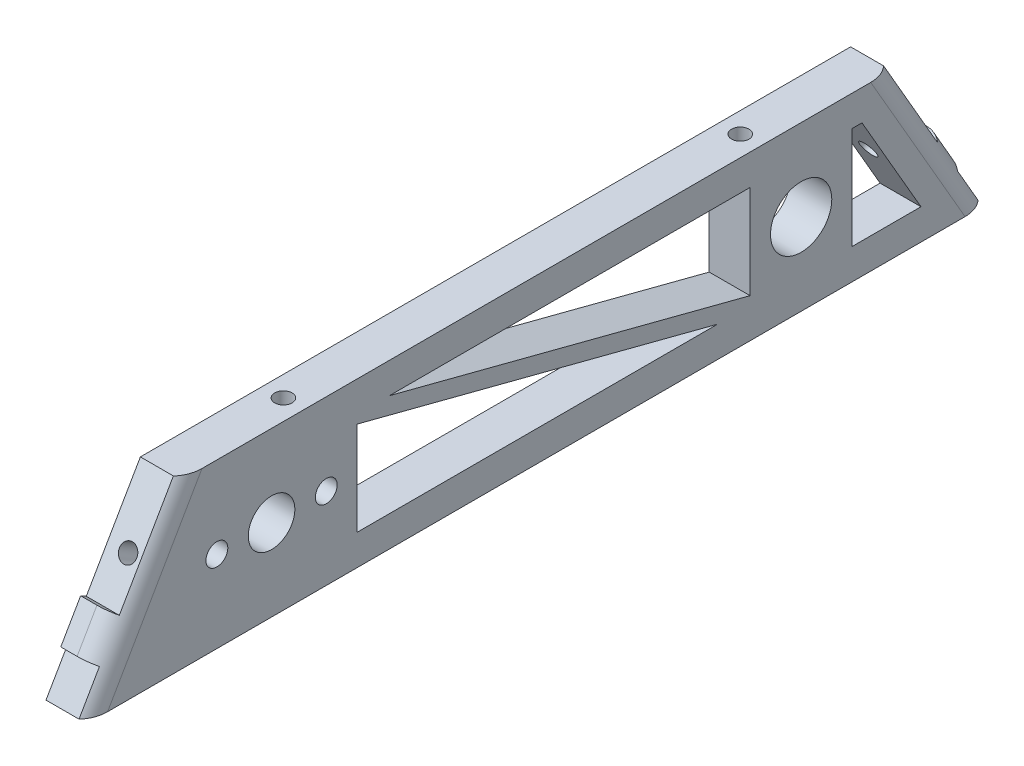
from build123d import *

# Parameters (mm, degrees)
SKETCH1_R                     = 3.6195
SKETCH1_R_2                   = 4.7625
SKETCH1_R_3                   = 1.6999966
BOSS_EXTRUDE1_DEPTH           = 6.35
TAP_DRILL_FOR_6_32_TAP4_D     = 2.7051
TAP_DRILL_FOR_6_32_TAP4_DEPTH = 10.16
TAP_DRILL_FOR_6_32_TAP4_TIP   = 0.81269403
TAP_DRILL_FOR_6_32_TAP3_D     = 2.7051
TAP_DRILL_FOR_6_32_TAP3_DEPTH = 10.16
TAP_DRILL_FOR_6_32_TAP3_TIP   = 0.81269403
SKETCH11_W                    = 6.35
SKETCH11_H                    = 6.1722
BOSS_EXTRUDE2_DEPTH           = 1.016
SKETCH12_W                    = 6.35
SKETCH12_H                    = 6.1722
BOSS_EXTRUDE3_DEPTH           = 1.016
TAP_DRILL_FOR_6_32_TAP1_D     = 2.7051
TAP_DRILL_FOR_6_32_TAP1_DEPTH = 7.62
TAP_DRILL_FOR_6_32_TAP1_TIP   = 0.81269403
TAP_DRILL_FOR_6_32_TAP2_D     = 2.7051
TAP_DRILL_FOR_6_32_TAP2_DEPTH = 7.62
TAP_DRILL_FOR_6_32_TAP2_TIP   = 0.81269403
CUT_EXTRUDE1_DEPTH            = 143.132235964
FILLET1_R                     = 3.81
FILLET2_R                     = 3.81


with BuildPart() as part:
    # Sketch1 → Boss-Extrude1 (new body)
    with BuildSketch(Plane(origin=(0, 0, 0), x_dir=(0, 0, -1), z_dir=(1, 0, 0))):
        Polygon((0, 0), (-14.664696837, 25.4), (-125.035303163, 25.4), (-139.7, 0), align=None)
        with Locations((-110.998, 12.7)):
            Circle(SKETCH1_R, mode=Mode.SUBTRACT)
        with Locations((-28.702, 12.7)):
            Circle(SKETCH1_R_2, mode=Mode.SUBTRACT)
        with Locations((-102.4979916, 12.7)):
            Circle(SKETCH1_R_3, mode=Mode.SUBTRACT)
        with Locations((-119.4980084, 12.7)):
            Circle(SKETCH1_R_3, mode=Mode.SUBTRACT)
    extrude(amount=BOSS_EXTRUDE1_DEPTH)

    # Tap Drill for #6-32 Tap4
    with Locations(Plane(origin=(0, 25.4, 0), x_dir=(1, 0, 0), z_dir=(0, 1, 0))):
        with Locations((3.175, -105.985303163), (3.175, -34.984696837)):
            Hole(TAP_DRILL_FOR_6_32_TAP4_D / 2, depth=TAP_DRILL_FOR_6_32_TAP4_DEPTH)
            with Locations((0, 0, -(TAP_DRILL_FOR_6_32_TAP4_DEPTH + TAP_DRILL_FOR_6_32_TAP4_TIP / 2))):  # 118° drill point
                Cone(0, TAP_DRILL_FOR_6_32_TAP4_D / 2, TAP_DRILL_FOR_6_32_TAP4_TIP, mode=Mode.SUBTRACT)

    # Tap Drill for #6-32 Tap3
    with Locations(Plane(origin=(0, 0, 0), x_dir=(-1, 0, 0), z_dir=(0, -1, 0))):
        with Locations((-3.175, -105.41), (-3.175, -22.86)):
            Hole(TAP_DRILL_FOR_6_32_TAP3_D / 2, depth=TAP_DRILL_FOR_6_32_TAP3_DEPTH)
            with Locations((0, 0, -(TAP_DRILL_FOR_6_32_TAP3_DEPTH + TAP_DRILL_FOR_6_32_TAP3_TIP / 2))):  # 118° drill point
                Cone(0, TAP_DRILL_FOR_6_32_TAP3_D / 2, TAP_DRILL_FOR_6_32_TAP3_TIP, mode=Mode.SUBTRACT)

    # Sketch11 → Boss-Extrude2 (add)
    with BuildSketch(Plane(origin=(0, 60.491874454, 104.775), x_dir=(1, 0, 0), z_dir=(0, 0.5000000000000037, 0.8660254037844365))):
        with Locations((3.175, -60.4139)):
            Rectangle(SKETCH11_W, SKETCH11_H)
    extrude(amount=BOSS_EXTRUDE2_DEPTH)

    # Sketch12 → Boss-Extrude3 (add)
    with BuildSketch(Plane(origin=(0, 0, 0), x_dir=(-1, 0, 0), z_dir=(0, 0.49999999999999806, -0.8660254037844398))):
        with Locations((-3.175, 9.4361)):
            Rectangle(SKETCH12_W, SKETCH12_H)
    extrude(amount=BOSS_EXTRUDE3_DEPTH)

    # Tap Drill for #6-32 Tap1
    with Locations(Plane(origin=(0, 60.491874454, 104.775), x_dir=(1, 0, 0), z_dir=(0, 0.5000000000000037, 0.8660254037844365))):
        with Locations((3.175, -50.680606325)):
            Hole(TAP_DRILL_FOR_6_32_TAP1_D / 2, depth=TAP_DRILL_FOR_6_32_TAP1_DEPTH)
            with Locations((0, 0, -(TAP_DRILL_FOR_6_32_TAP1_DEPTH + TAP_DRILL_FOR_6_32_TAP1_TIP / 2))):  # 118° drill point
                Cone(0, TAP_DRILL_FOR_6_32_TAP1_D / 2, TAP_DRILL_FOR_6_32_TAP1_TIP, mode=Mode.SUBTRACT)

    # Tap Drill for #6-32 Tap2
    with Locations(Plane(origin=(0, 0, 0), x_dir=(-1, 0, 0), z_dir=(0, 0.49999999999999806, -0.8660254037844398))):
        with Locations((-3.175, 19.169393675)):
            Hole(TAP_DRILL_FOR_6_32_TAP2_D / 2, depth=TAP_DRILL_FOR_6_32_TAP2_DEPTH)
            with Locations((0, 0, -(TAP_DRILL_FOR_6_32_TAP2_DEPTH + TAP_DRILL_FOR_6_32_TAP2_TIP / 2))):  # 118° drill point
                Cone(0, TAP_DRILL_FOR_6_32_TAP2_D / 2, TAP_DRILL_FOR_6_32_TAP2_TIP, mode=Mode.SUBTRACT)

    # Sketch19 → Cut-Extrude1 (cut, through all)
    with BuildSketch(Plane.ZY):
        Polygon((92.68551049, 20.6375), (36.6395, 20.6375), (36.6395, 6.07467201), align=None)
        Polygon((97.7354916, 4.7625), (97.7354916, 19.32532799), (41.68948111, 4.7625), align=None)
        Polygon((20.7645, 20.6375), (20.7645, 4.7625), (10.081979076, 4.7625), (19.247414599, 20.6375), align=None)
    extrude(amount=-CUT_EXTRUDE1_DEPTH, mode=Mode.SUBTRACT)

    # Fillet1
    fillet1_edges = [part.edges().sort_by_distance(p)[0] for p in [
        (6.35, 8.679902313, 135.86183181),
    ]]
    fillet(fillet1_edges, radius=FILLET1_R)

    # Fillet2
    fillet2_edges = [part.edges().sort_by_distance(p)[0] for p in [
        (6.35, 8.679902313, 3.83816819),
    ]]
    fillet(fillet2_edges, radius=FILLET2_R)


solid = part.part
